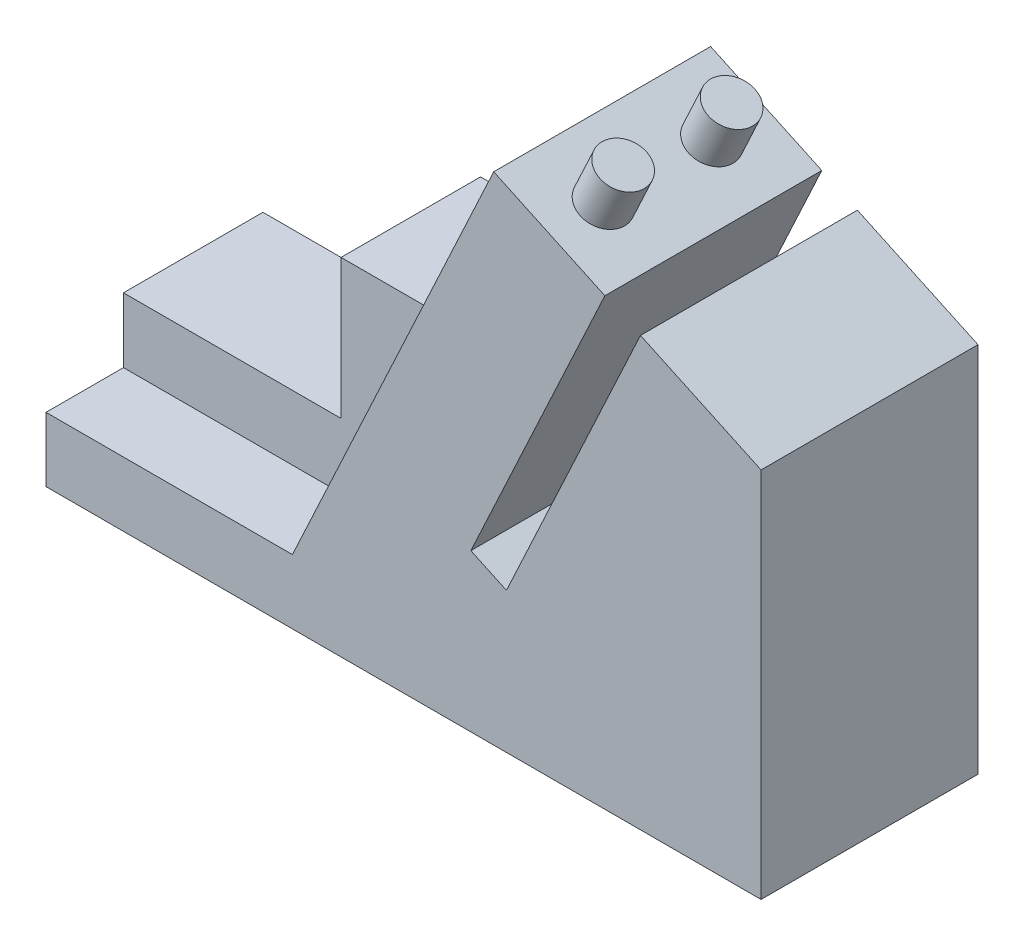
from build123d import *

# Parameters (mm, degrees)
BOSS_EXTRUDE3_DEPTH = 28000
BOSS_EXTRUDE4_DEPTH = 18000
SKETCH7_R           = 3000
BOSS_EXTRUDE6_DEPTH = 6000


with BuildPart() as part:
    # Sketch1 → Boss-Extrude3 (new body)
    with BuildSketch(Plane.XY):
        Polygon((60289.575671437, -8339.25974013), (-32008.795270492, -8339.25974013), (-32008.795270492, -32.960143443), (-203.517816426, -32.960143443), (25778.694164292, 55752.377344568), (40128.414231199, 49068.946080529), (22828.624558736, 11925.280019065), (27422.069474156, 9785.867318732), (44721.859146619, 46929.533380197), (60289.575671437, 39678.816094665), align=None)
    extrude(amount=BOSS_EXTRUDE3_DEPTH)

    # Sketch4 → Boss-Extrude4 (add)
    with BuildSketch(Plane.XY):
        Polygon((-32008.795270492, -32.960143443), (-32008.795270492, 8328.712203679), (-3925.478641054, 8328.712203679), (-3925.478641054, 26328.712203679), (12074.521358946, 26328.712203679), (-203.517816426, -32.960143443), align=None)
    extrude(amount=BOSS_EXTRUDE4_DEPTH)

    # Sketch7 → Boss-Extrude6 (add)
    with BuildSketch(Plane(origin=(25933.31858491, 55680.360491129, 0), x_dir=(0.9065001283244669, -0.4222055392196143, 0), z_dir=(0.4222055392196143, 0.9065001283244669, 0))):
        with Locations(Location((7744.3294198, -21000, 0), (0, 0, 180))):
            Circle(SKETCH7_R)
        with Locations(Location((7744.3294198, -7000, 0), (0, 0, 180))):
            Circle(SKETCH7_R)
    extrude(amount=BOSS_EXTRUDE6_DEPTH)


solid = part.part
